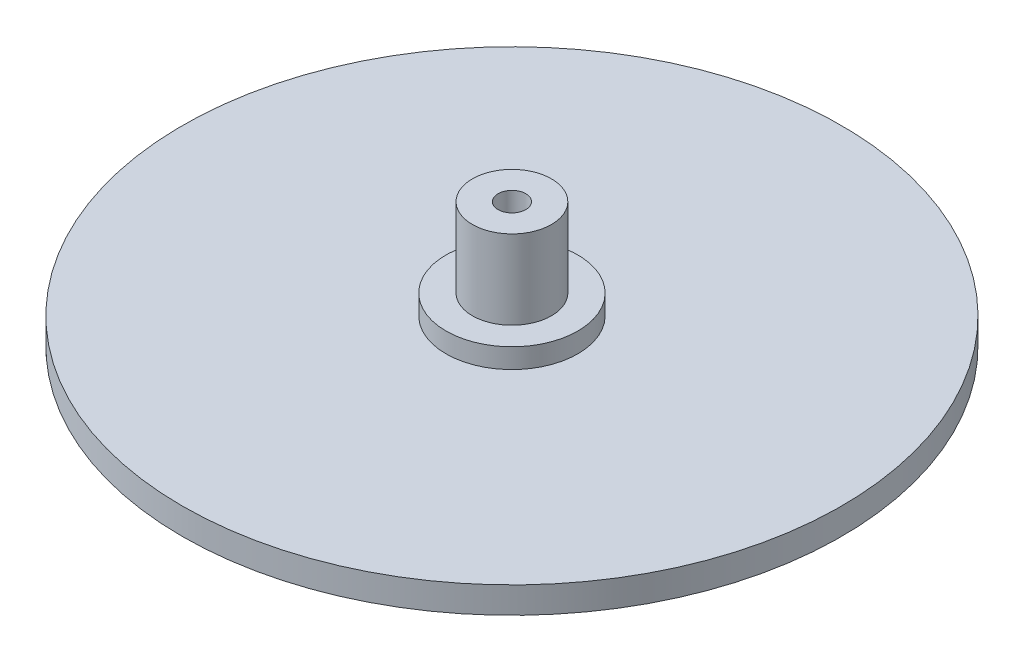
from build123d import *

# Parameters (mm, degrees)
SKETCH1_R           = 25
BOSS_EXTRUDE1_DEPTH = 2
SKETCH2_R           = 5
BOSS_EXTRUDE2_DEPTH = 1.5
SKETCH3_R           = 3
BOSS_EXTRUDE3_DEPTH = 6
SKETCH4_R           = 1.05
CUT_EXTRUDE1_DEPTH  = 9


with BuildPart() as part:
    # Sketch1 → Boss-Extrude1 (new body)
    with BuildSketch(Plane(origin=(0, 0, 0), x_dir=(1, 0, 0), z_dir=(0, 1, 0))):
        with Locations(Location((0, 0, 0), (0, 0, 270))):
            Circle(SKETCH1_R)
    extrude(amount=BOSS_EXTRUDE1_DEPTH)

    # Sketch2 → Boss-Extrude2 (add)
    with BuildSketch(Plane(origin=(0, 2, 0), x_dir=(1, 0, 0), z_dir=(0, 1, 0))):
        with Locations(Location((0, 0, 0), (0, 0, 270))):
            Circle(SKETCH2_R)
    extrude(amount=BOSS_EXTRUDE2_DEPTH)

    # Sketch3 → Boss-Extrude3 (add)
    with BuildSketch(Plane(origin=(0, 3.5, 0), x_dir=(1, 0, 0), z_dir=(0, 1, 0))):
        with Locations(Location((0, 0, 0), (0, 0, 270))):
            Circle(SKETCH3_R)
    extrude(amount=BOSS_EXTRUDE3_DEPTH)

    # Sketch4 → Cut-Extrude1 (cut)
    with BuildSketch(Plane(origin=(0, 9.5, 0), x_dir=(1, 0, 0), z_dir=(0, 1, 0))):
        with Locations(Location((0, 0, 0), (0, 0, 270))):
            Circle(SKETCH4_R)
    extrude(amount=-CUT_EXTRUDE1_DEPTH, mode=Mode.SUBTRACT)


solid = part.part
